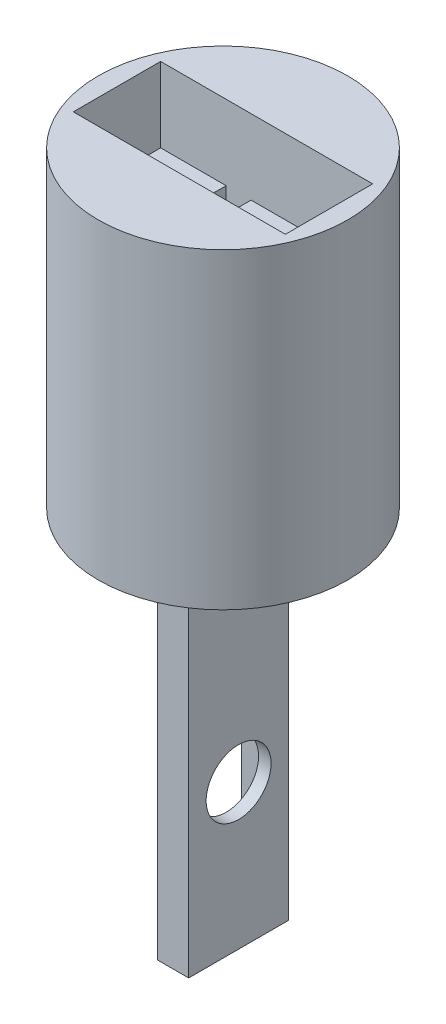
from build123d import *

# Parameters (mm, degrees)
SKETCH3_R           = 10
BOSS_EXTRUDE1_DEPTH = 25
SKETCH4_W           = 2.5
SKETCH4_H           = 8
BOSS_EXTRUDE2_DEPTH = 30
CUT_EXTRUDE1_REACH  = 35.564
SKETCH5_R           = 2.6
SKETCH6_W           = 5.5
SKETCH6_H           = 21.2
CUT_EXTRUDE2_DEPTH  = 1.5
SKETCH7_W           = 17
SKETCH7_H           = 7
CUT_EXTRUDE3_DEPTH  = 6
SKETCH8_W           = 2
SKETCH8_H           = 7
CUT_EXTRUDE4_DEPTH  = 4


with BuildPart() as part:
    # Sketch3 → Boss-Extrude1 (new body)
    with BuildSketch(Plane(origin=(0, 0, 0), x_dir=(1, 0, 0), z_dir=(0, 1, 0))):
        with Locations(Location((0, 0, 0), (0, 0, 270))):
            Circle(SKETCH3_R)
    extrude(amount=BOSS_EXTRUDE1_DEPTH)

    # Sketch4 → Boss-Extrude2 (add)
    with BuildSketch(Plane(origin=(0, 0, 0), x_dir=(-1, 0, 0), z_dir=(0, -1, 0))):
        Rectangle(SKETCH4_W, SKETCH4_H)
    extrude(amount=BOSS_EXTRUDE2_DEPTH)

    # Sketch5 → Cut-Extrude1 (cut, up to next)
    with BuildSketch(Plane(origin=(1.25, 0, 0), x_dir=(0, 0, -1), z_dir=(1, 0, 0)), mode=Mode.PRIVATE) as cut_extrude1_sk1:
        with Locations((0, -18.4)):
            Circle(SKETCH5_R)
    cut_extrude1_tool1 = extrude(cut_extrude1_sk1.sketch, amount=-CUT_EXTRUDE1_REACH, mode=Mode.PRIVATE) & part.part
    add(cut_extrude1_tool1.solids().sort_by_distance((1.25, -18.4, 0))[0], mode=Mode.SUBTRACT)

    # Sketch6 → Cut-Extrude2 (cut)
    with BuildSketch(Plane.ZY.offset(1.25)):
        with Locations((0, -18.4)):
            Rectangle(SKETCH6_W, SKETCH6_H)
    extrude(amount=-CUT_EXTRUDE2_DEPTH, mode=Mode.SUBTRACT)

    # Sketch7 → Cut-Extrude3 (cut)
    with BuildSketch(Plane(origin=(0, 25, 0), x_dir=(1, 0, 0), z_dir=(0, 1, 0))):
        Rectangle(SKETCH7_W, SKETCH7_H)
    extrude(amount=-CUT_EXTRUDE3_DEPTH, mode=Mode.SUBTRACT)

    # Sketch8 → Cut-Extrude4 (cut)
    with BuildSketch(Plane(origin=(0, 19, 0), x_dir=(1, 0, 0), z_dir=(0, 1, 0))):
        with Locations((-2.25, 0)):
            Rectangle(SKETCH8_W, SKETCH8_H)
    extrude(amount=-CUT_EXTRUDE4_DEPTH, mode=Mode.SUBTRACT)


solid = part.part
